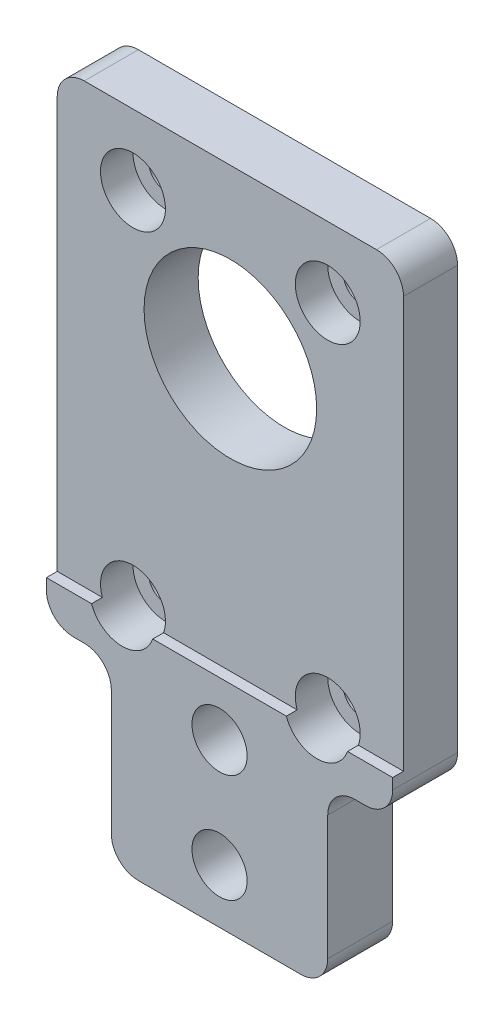
from build123d import *
from build123d.topology import SkipClean

# Parameters (mm, degrees)
SKETCH1_R           = 2.55
BOSS_EXTRUDE2_DEPTH = 6
SKETCH7_W           = 32
SKETCH7_H           = 44
BOSS_EXTRUDE3_DEPTH = 6
FILLET1_R           = 2.5
SKETCH3_R           = 7.975
CUT_EXTRUDE2_DEPTH  = 49.602983448
SKETCH2_R           = 1.55
CUT_EXTRUDE1_DEPTH  = 49.602983448
SKETCH6_W           = 60
SKETCH6_H           = 50
CUT_EXTRUDE5_DEPTH  = 1
SKETCH8_R           = 3
CUT_EXTRUDE6_DEPTH  = 4
SKETCH9_R           = 2.55
CUT_EXTRUDE7_DEPTH  = 49.602983448


with BuildPart() as part:
    # Sketch1 → Boss-Extrude2 (new body)
    with BuildSketch(Plane.XY):
        with BuildLine():
            Line((-10, -15), (-10, 15))
            Line((-10, 15), (-15, 30))
            ThreePointArc((-15, 30), (0, 45), (15, 30))
            Line((15, 30), (10, 15))
            Line((10, 15), (10, -15))
            Line((10, -15), (-10, -15))
        make_face()
        Circle(SKETCH1_R, mode=Mode.SUBTRACT)
        with Locations((0, -10)):
            Circle(SKETCH1_R, mode=Mode.SUBTRACT)
    extrude(amount=BOSS_EXTRUDE2_DEPTH)

    # Sketch7 → Boss-Extrude3 (add)
    with BuildSketch(Plane(origin=(0, 0, 0), x_dir=(-1, 0, 0), z_dir=(0, 0, -1))):
        with Locations((0, 23.5)):
            Rectangle(SKETCH7_W, SKETCH7_H)
    extrude(amount=-BOSS_EXTRUDE3_DEPTH)

    # Fillet1
    fillet1_edges = [part.edges().sort_by_distance(p)[0] for p in [
        (10, -15, 3),
        (-10, -15, 3),
        (-16, 1.5, 3),
        (-10, 1.5, 3),
        (10, 1.5, 3),
        (16, 1.5, 3),
        (16, 45.5, 3),
        (-16, 45.5, 3),
    ]]
    fillet(fillet1_edges, radius=FILLET1_R)

    # Sketch3 → Cut-Extrude2 (cut, through all)
    with BuildSketch(Plane.XY.offset(6)):
        with Locations((0, 30)):
            Circle(SKETCH3_R)
    extrude(amount=-CUT_EXTRUDE2_DEPTH, mode=Mode.SUBTRACT)

    # Sketch2 → Cut-Extrude1 (cut, through all)
    with BuildSketch(Plane.XY.offset(6)):
        with Locations((-9, 39)):
            Circle(SKETCH2_R)
        with Locations((9, 39)):
            Circle(SKETCH2_R)
        with Locations((9, 6)):
            Circle(SKETCH2_R)
        with Locations((-9, 6)):
            Circle(SKETCH2_R)
    extrude(amount=-CUT_EXTRUDE1_DEPTH, mode=Mode.SUBTRACT)

    # Sketch6 → Cut-Extrude5 (cut)
    with BuildSketch(Plane.XY.offset(6)):
        with Locations((0, 30)):
            Rectangle(SKETCH6_W, SKETCH6_H)
    extrude(amount=-CUT_EXTRUDE5_DEPTH, mode=Mode.SUBTRACT)

    # Sketch8 → Cut-Extrude6 (cut)
    with BuildSketch(Plane.XY.offset(6)):
        with Locations((-9, 39)):
            Circle(SKETCH8_R)
        with Locations((9, 39)):
            Circle(SKETCH8_R)
        with Locations((9, 6)):
            Circle(SKETCH8_R)
        with Locations((-9, 6)):
            Circle(SKETCH8_R)
    extrude(amount=-CUT_EXTRUDE6_DEPTH, mode=Mode.SUBTRACT)

    # Sketch9 → Cut-Extrude7 (cut, through all)
    with SkipClean():  # the faces are left unmerged after this step: merging them gives an invalid solid
        with BuildSketch(Plane.XY.offset(6)):
            with Locations((0, -10)):
                Circle(SKETCH9_R)
            Circle(SKETCH9_R)
        extrude(amount=-CUT_EXTRUDE7_DEPTH, mode=Mode.SUBTRACT)


solid = part.part
